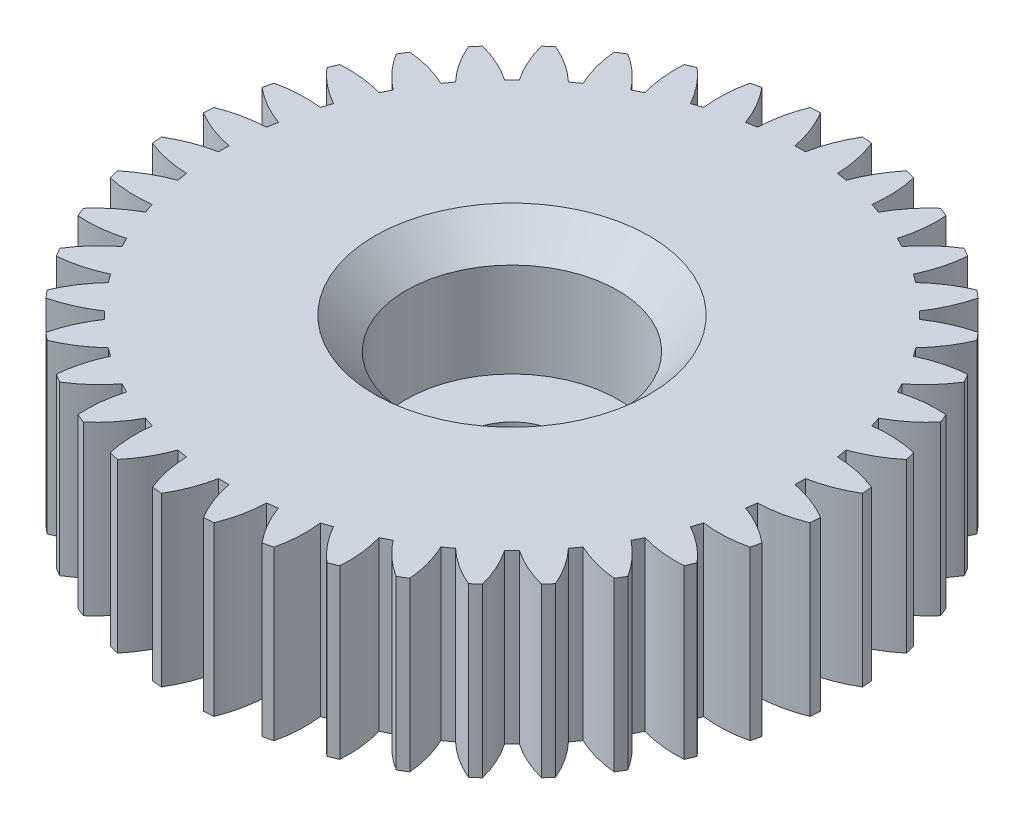
from build123d import *

# Parameters (mm, degrees)
SKETCH1_R           = 2.525
SKETCH1_R_2         = 1.125
BOSS_EXTRUDE1_DEPTH = 1
SKETCH1_3_R         = 7.875
SKETCH1_3_R_2       = 2.525
BOSS_EXTRUDE2_DEPTH = 4
CUT_EXTRUDE1_DEPTH  = 12.833480046
CIRPATTERN3_COUNT   = 40
FILLET1_R           = 0.4
CHAMFER1_SIZE       = 0.75


with BuildPart() as part:
    # Sketch1 → Boss-Extrude1 (new body)
    with BuildSketch(Plane(origin=(0, 0, 0), x_dir=(1, 0, 0), z_dir=(0, 1, 0))):
        Circle(SKETCH1_R)
        Circle(SKETCH1_R_2, mode=Mode.SUBTRACT)
    extrude(amount=BOSS_EXTRUDE1_DEPTH)

    # Sketch1<3> → Boss-Extrude2 (add)
    with BuildSketch(Plane(origin=(0, 0, 0), x_dir=(1, 0, 0), z_dir=(0, 1, 0))):
        Circle(SKETCH1_3_R)
        Circle(SKETCH1_3_R_2, mode=Mode.SUBTRACT)
    extrude(amount=BOSS_EXTRUDE2_DEPTH)

    # Sketch1<5> → Cut-Extrude1 (cut, through all)
    with BuildSketch(Plane(origin=(0, 0, 0), x_dir=(1, 0, 0), z_dir=(0, 1, 0))):
        with BuildLine():
            ThreePointArc((0.125, 6.873863542), (0.268883758, 7.383088247), (0.5, 7.859110955))
            ThreePointArc((0.5, 7.859110955), (0, 7.875), (-0.5, 7.859110955))
            ThreePointArc((-0.5, 7.859110955), (-0.268883758, 7.383088247), (-0.125, 6.873863542))
            ThreePointArc((-0.125, 6.873863542), (0, 6.875), (0.125, 6.873863542))
        make_face()
    cut_extrude1 = extrude(amount=CUT_EXTRUDE1_DEPTH, mode=Mode.SUBTRACT)

    # CirPattern3: Cut-Extrude1 ×40 about axis
    cirpattern3_axis = Axis((0, 4, 0), (0, -1, 0))
    for i in range(1, CIRPATTERN3_COUNT):
        add(cut_extrude1.rotate(cirpattern3_axis, i * 360 / CIRPATTERN3_COUNT), mode=Mode.SUBTRACT)

    # Fillet1
    fillet1_edges = [part.edges().sort_by_distance(p)[0] for p in [
        (-1.125, 0, 0),
    ]]
    fillet(fillet1_edges, radius=FILLET1_R)

    # Chamfer1
    chamfer1_edges = [part.edges().sort_by_distance(p)[0] for p in [
        (-2.525, 4, 0),
    ]]
    chamfer(chamfer1_edges, length=CHAMFER1_SIZE)


solid = part.part
